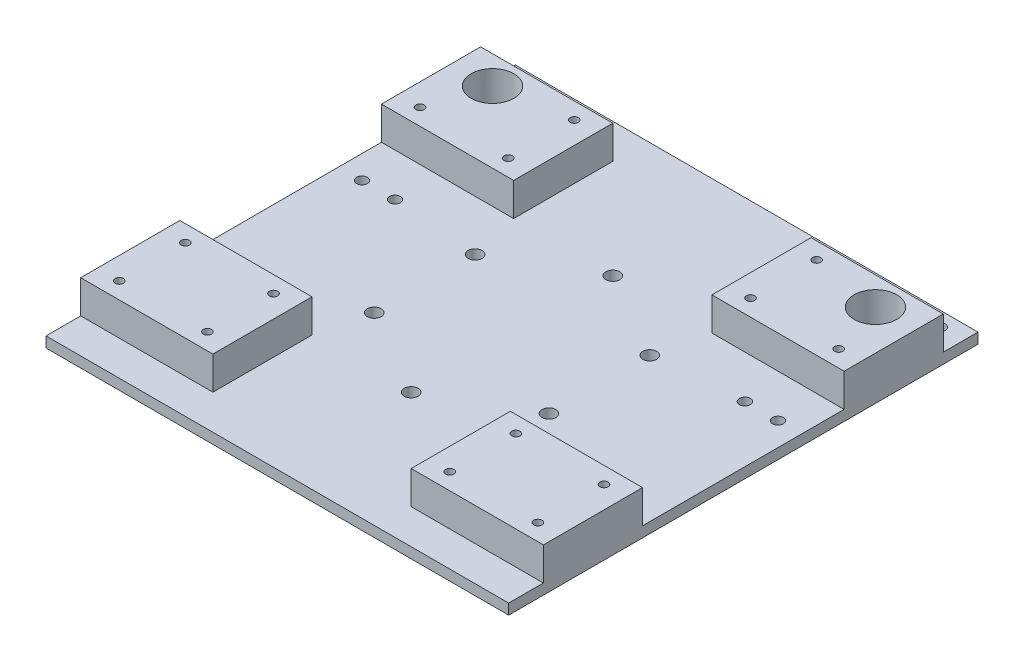
from build123d import *

# Parameters (mm, degrees)
SKETCH1_W                      = 140
SKETCH1_H                      = 142
BOSS_EXTRUDE1_DEPTH            = 3.175
SKETCH2_W                      = 40
SKETCH2_H                      = 30
SKETCH2_R                      = 1.25
BOSS_EXTRUDE2_DEPTH            = 10
CUT_EXTRUDE1_REACH             = 102.205
SKETCH4_R                      = 6.4643
SKETCH4_R_2                    = 1.65
CUT_EXTRUDE1_DIRECTION_2_REACH = 102.205
SKETCH5_R                      = 2.1
CUT_EXTRUDE2_DEPTH             = 3.175
CUT_EXTRUDE3_START             = -3.175
SKETCH6_R                      = 1.25
CUT_EXTRUDE3_DEPTH             = 3.175


with BuildPart() as part:
    # Sketch1 → Boss-Extrude1 (new body)
    with BuildSketch(Plane(origin=(0, 0, 0), x_dir=(1, 0, 0), z_dir=(0, 1, 0))):
        Rectangle(SKETCH1_W, SKETCH1_H)
    extrude(amount=BOSS_EXTRUDE1_DEPTH)

    # Sketch2 → Boss-Extrude2 (add)
    # profile 1 of 4: a face of its own
    with BuildSketch(Plane(origin=(0, 3.175, 0), x_dir=(1, 0, 0), z_dir=(0, 1, 0))):
        with Locations((-50, 45.5)):
            Rectangle(SKETCH2_W, SKETCH2_H)
        with Locations(Location((-36.666666667, 55.5, 0), (0, 0, 270))):
            Circle(SKETCH2_R, mode=Mode.SUBTRACT)
        with Locations(Location((-36.666666667, 35.5, 0), (0, 0, 90))):
            Circle(SKETCH2_R, mode=Mode.SUBTRACT)
        with Locations(Location((-63.333333333, 35.5, 0), (0, 0, 270))):
            Circle(SKETCH2_R, mode=Mode.SUBTRACT)
    # profile 2 of 4: a face of its own
    with BuildSketch(Plane(origin=(0, 3.175, 0), x_dir=(1, 0, 0), z_dir=(0, 1, 0))):
        with Locations((50, 45.5)):
            Rectangle(SKETCH2_W, SKETCH2_H)
        with Locations(Location((36.666666667, 35.5, 0), (0, 0, 270))):
            Circle(SKETCH2_R, mode=Mode.SUBTRACT)
        with Locations(Location((63.333333333, 35.5, 0), (0, 0, 90))):
            Circle(SKETCH2_R, mode=Mode.SUBTRACT)
        with Locations(Location((36.666666667, 55.5, 0), (0, 0, 90))):
            Circle(SKETCH2_R, mode=Mode.SUBTRACT)
    # profile 3 of 4: a face of its own
    with BuildSketch(Plane(origin=(0, 3.175, 0), x_dir=(1, 0, 0), z_dir=(0, 1, 0))):
        with Locations((50, -45.5)):
            Rectangle(SKETCH2_W, SKETCH2_H)
        with Locations(Location((63.333333333, -35.5, 0), (0, 0, 270))):
            Circle(SKETCH2_R, mode=Mode.SUBTRACT)
        with Locations(Location((63.333333333, -55.5, 0), (0, 0, 90))):
            Circle(SKETCH2_R, mode=Mode.SUBTRACT)
        with Locations(Location((36.666666667, -55.5, 0), (0, 0, 270))):
            Circle(SKETCH2_R, mode=Mode.SUBTRACT)
        with Locations(Location((36.666666667, -35.5, 0), (0, 0, 90))):
            Circle(SKETCH2_R, mode=Mode.SUBTRACT)
    # profile 4 of 4: a face of its own
    with BuildSketch(Plane(origin=(0, 3.175, 0), x_dir=(1, 0, 0), z_dir=(0, 1, 0))):
        with Locations((-50, -45.5)):
            Rectangle(SKETCH2_W, SKETCH2_H)
        with Locations(Location((-36.666666667, -35.5, 0), (0, 0, 270))):
            Circle(SKETCH2_R, mode=Mode.SUBTRACT)
        with Locations(Location((-63.333333333, -35.5, 0), (0, 0, 90))):
            Circle(SKETCH2_R, mode=Mode.SUBTRACT)
        with Locations(Location((-36.666666667, -55.5, 0), (0, 0, 90))):
            Circle(SKETCH2_R, mode=Mode.SUBTRACT)
        with Locations(Location((-63.333333333, -55.5, 0), (0, 0, 270))):
            Circle(SKETCH2_R, mode=Mode.SUBTRACT)
    extrude(amount=BOSS_EXTRUDE2_DEPTH)

    # Cut-Extrude1: up to this face of the body (flat: up to its plane)
    cut_extrude1_end = Plane(part.part.faces().sort_by_distance((0, 0, 0))[0])
    # Sketch4 → Cut-Extrude1 (cut, up to the picked face)
    with BuildSketch(Plane(origin=(0, 3.175, 0), x_dir=(1, 0, 0), z_dir=(0, 1, 0)), mode=Mode.PRIVATE) as cut_extrude1_sk1:
        with Locations(Location((57.9286, 52.0357, 0), (0, 0, 270))):
            Circle(SKETCH4_R)
    cut_extrude1_tool1 = split(extrude(cut_extrude1_sk1.sketch, amount=-CUT_EXTRUDE1_REACH, mode=Mode.PRIVATE), bisect_by=cut_extrude1_end, keep=Keep.BOTH, mode=Mode.PRIVATE)
    # Sketch4 → Cut-Extrude1 (cut, up to the picked face)
    with BuildSketch(Plane(origin=(0, 3.175, 0), x_dir=(1, 0, 0), z_dir=(0, 1, 0)), mode=Mode.PRIVATE) as cut_extrude1_sk2:
        with Locations(Location((62.9286, 17.5357, 0), (0, 0, 90))):
            Circle(SKETCH4_R_2)
    cut_extrude1_tool2 = split(extrude(cut_extrude1_sk2.sketch, amount=-CUT_EXTRUDE1_REACH, mode=Mode.PRIVATE), bisect_by=cut_extrude1_end, keep=Keep.BOTH, mode=Mode.PRIVATE)
    # Sketch4 → Cut-Extrude1 (cut, up to the picked face)
    with BuildSketch(Plane(origin=(0, 3.175, 0), x_dir=(1, 0, 0), z_dir=(0, 1, 0)), mode=Mode.PRIVATE) as cut_extrude1_sk3:
        with Locations(Location((-62.9286, 66.5357, 0), (0, 0, 90))):
            Circle(SKETCH4_R_2)
    cut_extrude1_tool3 = split(extrude(cut_extrude1_sk3.sketch, amount=-CUT_EXTRUDE1_REACH, mode=Mode.PRIVATE), bisect_by=cut_extrude1_end, keep=Keep.BOTH, mode=Mode.PRIVATE)
    # Sketch4 → Cut-Extrude1 (cut, up to the picked face)
    with BuildSketch(Plane(origin=(0, 3.175, 0), x_dir=(1, 0, 0), z_dir=(0, 1, 0)), mode=Mode.PRIVATE) as cut_extrude1_sk4:
        with Locations(Location((-52.9286, 66.5357, 0), (0, 0, 90))):
            Circle(SKETCH4_R_2)
    cut_extrude1_tool4 = split(extrude(cut_extrude1_sk4.sketch, amount=-CUT_EXTRUDE1_REACH, mode=Mode.PRIVATE), bisect_by=cut_extrude1_end, keep=Keep.BOTH, mode=Mode.PRIVATE)
    # Sketch4 → Cut-Extrude1 (cut, up to the picked face)
    with BuildSketch(Plane(origin=(0, 3.175, 0), x_dir=(1, 0, 0), z_dir=(0, 1, 0)), mode=Mode.PRIVATE) as cut_extrude1_sk5:
        with Locations(Location((-57.9286, 52.0357, 0), (0, 0, 270))):
            Circle(SKETCH4_R)
    cut_extrude1_tool5 = split(extrude(cut_extrude1_sk5.sketch, amount=-CUT_EXTRUDE1_REACH, mode=Mode.PRIVATE), bisect_by=cut_extrude1_end, keep=Keep.BOTH, mode=Mode.PRIVATE)
    # Sketch4 → Cut-Extrude1 (cut, up to the picked face)
    with BuildSketch(Plane(origin=(0, 3.175, 0), x_dir=(1, 0, 0), z_dir=(0, 1, 0)), mode=Mode.PRIVATE) as cut_extrude1_sk6:
        with Locations(Location((-62.9286, 17.5357, 0), (0, 0, 90))):
            Circle(SKETCH4_R_2)
    cut_extrude1_tool6 = split(extrude(cut_extrude1_sk6.sketch, amount=-CUT_EXTRUDE1_REACH, mode=Mode.PRIVATE), bisect_by=cut_extrude1_end, keep=Keep.BOTH, mode=Mode.PRIVATE)
    # Sketch4 → Cut-Extrude1 (cut, up to the picked face)
    with BuildSketch(Plane(origin=(0, 3.175, 0), x_dir=(1, 0, 0), z_dir=(0, 1, 0)), mode=Mode.PRIVATE) as cut_extrude1_sk7:
        with Locations(Location((-52.9286, 17.5357, 0), (0, 0, 90))):
            Circle(SKETCH4_R_2)
    cut_extrude1_tool7 = split(extrude(cut_extrude1_sk7.sketch, amount=-CUT_EXTRUDE1_REACH, mode=Mode.PRIVATE), bisect_by=cut_extrude1_end, keep=Keep.BOTH, mode=Mode.PRIVATE)
    # Sketch4 → Cut-Extrude1 (cut, up to the picked face)
    with BuildSketch(Plane(origin=(0, 3.175, 0), x_dir=(1, 0, 0), z_dir=(0, 1, 0)), mode=Mode.PRIVATE) as cut_extrude1_sk8:
        with Locations(Location((52.9286, 66.5357, 0), (0, 0, 90))):
            Circle(SKETCH4_R_2)
    cut_extrude1_tool8 = split(extrude(cut_extrude1_sk8.sketch, amount=-CUT_EXTRUDE1_REACH, mode=Mode.PRIVATE), bisect_by=cut_extrude1_end, keep=Keep.BOTH, mode=Mode.PRIVATE)
    # Sketch4 → Cut-Extrude1 (cut, up to the picked face)
    with BuildSketch(Plane(origin=(0, 3.175, 0), x_dir=(1, 0, 0), z_dir=(0, 1, 0)), mode=Mode.PRIVATE) as cut_extrude1_sk9:
        with Locations(Location((62.9286, 66.5357, 0), (0, 0, 90))):
            Circle(SKETCH4_R_2)
    cut_extrude1_tool9 = split(extrude(cut_extrude1_sk9.sketch, amount=-CUT_EXTRUDE1_REACH, mode=Mode.PRIVATE), bisect_by=cut_extrude1_end, keep=Keep.BOTH, mode=Mode.PRIVATE)
    # Sketch4 → Cut-Extrude1 (cut, up to the picked face)
    with BuildSketch(Plane(origin=(0, 3.175, 0), x_dir=(1, 0, 0), z_dir=(0, 1, 0)), mode=Mode.PRIVATE) as cut_extrude1_sk10:
        with Locations(Location((52.9286, 17.5357, 0), (0, 0, 90))):
            Circle(SKETCH4_R_2)
    cut_extrude1_tool10 = split(extrude(cut_extrude1_sk10.sketch, amount=-CUT_EXTRUDE1_REACH, mode=Mode.PRIVATE), bisect_by=cut_extrude1_end, keep=Keep.BOTH, mode=Mode.PRIVATE)
    add(cut_extrude1_tool1.solids().sort_by(Axis((57.9286, 3.175, -52.0357), (0, -1, 0)))[0], mode=Mode.SUBTRACT)
    add(cut_extrude1_tool2.solids().sort_by(Axis((62.9286, 3.175, -17.5357), (0, -1, 0)))[0], mode=Mode.SUBTRACT)
    add(cut_extrude1_tool3.solids().sort_by(Axis((-62.9286, 3.175, -66.5357), (0, -1, 0)))[0], mode=Mode.SUBTRACT)
    add(cut_extrude1_tool4.solids().sort_by(Axis((-52.9286, 3.175, -66.5357), (0, -1, 0)))[0], mode=Mode.SUBTRACT)
    add(cut_extrude1_tool5.solids().sort_by(Axis((-57.9286, 3.175, -52.0357), (0, -1, 0)))[0], mode=Mode.SUBTRACT)
    add(cut_extrude1_tool6.solids().sort_by(Axis((-62.9286, 3.175, -17.5357), (0, -1, 0)))[0], mode=Mode.SUBTRACT)
    add(cut_extrude1_tool7.solids().sort_by(Axis((-52.9286, 3.175, -17.5357), (0, -1, 0)))[0], mode=Mode.SUBTRACT)
    add(cut_extrude1_tool8.solids().sort_by(Axis((52.9286, 3.175, -66.5357), (0, -1, 0)))[0], mode=Mode.SUBTRACT)
    add(cut_extrude1_tool9.solids().sort_by(Axis((62.9286, 3.175, -66.5357), (0, -1, 0)))[0], mode=Mode.SUBTRACT)
    add(cut_extrude1_tool10.solids().sort_by(Axis((52.9286, 3.175, -17.5357), (0, -1, 0)))[0], mode=Mode.SUBTRACT)

    # Cut-Extrude1 direction 2: up to this face of the body (flat: up to its plane)
    cut_extrude1_direction_2_end = Plane(part.part.faces().sort_by_distance((50.05521918, 13.175, -45.541414385))[0])
    # Sketch4 → Cut-Extrude1 direction 2 (cut, up to the picked face)
    with BuildSketch(Plane(origin=(0, 3.175, 0), x_dir=(1, 0, 0), z_dir=(0, 1, 0)), mode=Mode.PRIVATE) as cut_extrude1_direction_2_sk1:
        with Locations(Location((57.9286, 52.0357, 0), (0, 0, 270))):
            Circle(SKETCH4_R)
    cut_extrude1_direction_2_tool1 = split(extrude(cut_extrude1_direction_2_sk1.sketch, amount=CUT_EXTRUDE1_DIRECTION_2_REACH, mode=Mode.PRIVATE), bisect_by=cut_extrude1_direction_2_end, keep=Keep.BOTH, mode=Mode.PRIVATE)
    # Sketch4 → Cut-Extrude1 direction 2 (cut, up to the picked face)
    with BuildSketch(Plane(origin=(0, 3.175, 0), x_dir=(1, 0, 0), z_dir=(0, 1, 0)), mode=Mode.PRIVATE) as cut_extrude1_direction_2_sk2:
        with Locations(Location((62.9286, 17.5357, 0), (0, 0, 90))):
            Circle(SKETCH4_R_2)
    cut_extrude1_direction_2_tool2 = split(extrude(cut_extrude1_direction_2_sk2.sketch, amount=CUT_EXTRUDE1_DIRECTION_2_REACH, mode=Mode.PRIVATE), bisect_by=cut_extrude1_direction_2_end, keep=Keep.BOTH, mode=Mode.PRIVATE)
    # Sketch4 → Cut-Extrude1 direction 2 (cut, up to the picked face)
    with BuildSketch(Plane(origin=(0, 3.175, 0), x_dir=(1, 0, 0), z_dir=(0, 1, 0)), mode=Mode.PRIVATE) as cut_extrude1_direction_2_sk3:
        with Locations(Location((-62.9286, 66.5357, 0), (0, 0, 90))):
            Circle(SKETCH4_R_2)
    cut_extrude1_direction_2_tool3 = split(extrude(cut_extrude1_direction_2_sk3.sketch, amount=CUT_EXTRUDE1_DIRECTION_2_REACH, mode=Mode.PRIVATE), bisect_by=cut_extrude1_direction_2_end, keep=Keep.BOTH, mode=Mode.PRIVATE)
    # Sketch4 → Cut-Extrude1 direction 2 (cut, up to the picked face)
    with BuildSketch(Plane(origin=(0, 3.175, 0), x_dir=(1, 0, 0), z_dir=(0, 1, 0)), mode=Mode.PRIVATE) as cut_extrude1_direction_2_sk4:
        with Locations(Location((-52.9286, 66.5357, 0), (0, 0, 90))):
            Circle(SKETCH4_R_2)
    cut_extrude1_direction_2_tool4 = split(extrude(cut_extrude1_direction_2_sk4.sketch, amount=CUT_EXTRUDE1_DIRECTION_2_REACH, mode=Mode.PRIVATE), bisect_by=cut_extrude1_direction_2_end, keep=Keep.BOTH, mode=Mode.PRIVATE)
    # Sketch4 → Cut-Extrude1 direction 2 (cut, up to the picked face)
    with BuildSketch(Plane(origin=(0, 3.175, 0), x_dir=(1, 0, 0), z_dir=(0, 1, 0)), mode=Mode.PRIVATE) as cut_extrude1_direction_2_sk5:
        with Locations(Location((-57.9286, 52.0357, 0), (0, 0, 270))):
            Circle(SKETCH4_R)
    cut_extrude1_direction_2_tool5 = split(extrude(cut_extrude1_direction_2_sk5.sketch, amount=CUT_EXTRUDE1_DIRECTION_2_REACH, mode=Mode.PRIVATE), bisect_by=cut_extrude1_direction_2_end, keep=Keep.BOTH, mode=Mode.PRIVATE)
    # Sketch4 → Cut-Extrude1 direction 2 (cut, up to the picked face)
    with BuildSketch(Plane(origin=(0, 3.175, 0), x_dir=(1, 0, 0), z_dir=(0, 1, 0)), mode=Mode.PRIVATE) as cut_extrude1_direction_2_sk6:
        with Locations(Location((-62.9286, 17.5357, 0), (0, 0, 90))):
            Circle(SKETCH4_R_2)
    cut_extrude1_direction_2_tool6 = split(extrude(cut_extrude1_direction_2_sk6.sketch, amount=CUT_EXTRUDE1_DIRECTION_2_REACH, mode=Mode.PRIVATE), bisect_by=cut_extrude1_direction_2_end, keep=Keep.BOTH, mode=Mode.PRIVATE)
    # Sketch4 → Cut-Extrude1 direction 2 (cut, up to the picked face)
    with BuildSketch(Plane(origin=(0, 3.175, 0), x_dir=(1, 0, 0), z_dir=(0, 1, 0)), mode=Mode.PRIVATE) as cut_extrude1_direction_2_sk7:
        with Locations(Location((-52.9286, 17.5357, 0), (0, 0, 90))):
            Circle(SKETCH4_R_2)
    cut_extrude1_direction_2_tool7 = split(extrude(cut_extrude1_direction_2_sk7.sketch, amount=CUT_EXTRUDE1_DIRECTION_2_REACH, mode=Mode.PRIVATE), bisect_by=cut_extrude1_direction_2_end, keep=Keep.BOTH, mode=Mode.PRIVATE)
    # Sketch4 → Cut-Extrude1 direction 2 (cut, up to the picked face)
    with BuildSketch(Plane(origin=(0, 3.175, 0), x_dir=(1, 0, 0), z_dir=(0, 1, 0)), mode=Mode.PRIVATE) as cut_extrude1_direction_2_sk8:
        with Locations(Location((52.9286, 66.5357, 0), (0, 0, 90))):
            Circle(SKETCH4_R_2)
    cut_extrude1_direction_2_tool8 = split(extrude(cut_extrude1_direction_2_sk8.sketch, amount=CUT_EXTRUDE1_DIRECTION_2_REACH, mode=Mode.PRIVATE), bisect_by=cut_extrude1_direction_2_end, keep=Keep.BOTH, mode=Mode.PRIVATE)
    # Sketch4 → Cut-Extrude1 direction 2 (cut, up to the picked face)
    with BuildSketch(Plane(origin=(0, 3.175, 0), x_dir=(1, 0, 0), z_dir=(0, 1, 0)), mode=Mode.PRIVATE) as cut_extrude1_direction_2_sk9:
        with Locations(Location((62.9286, 66.5357, 0), (0, 0, 90))):
            Circle(SKETCH4_R_2)
    cut_extrude1_direction_2_tool9 = split(extrude(cut_extrude1_direction_2_sk9.sketch, amount=CUT_EXTRUDE1_DIRECTION_2_REACH, mode=Mode.PRIVATE), bisect_by=cut_extrude1_direction_2_end, keep=Keep.BOTH, mode=Mode.PRIVATE)
    # Sketch4 → Cut-Extrude1 direction 2 (cut, up to the picked face)
    with BuildSketch(Plane(origin=(0, 3.175, 0), x_dir=(1, 0, 0), z_dir=(0, 1, 0)), mode=Mode.PRIVATE) as cut_extrude1_direction_2_sk10:
        with Locations(Location((52.9286, 17.5357, 0), (0, 0, 90))):
            Circle(SKETCH4_R_2)
    cut_extrude1_direction_2_tool10 = split(extrude(cut_extrude1_direction_2_sk10.sketch, amount=CUT_EXTRUDE1_DIRECTION_2_REACH, mode=Mode.PRIVATE), bisect_by=cut_extrude1_direction_2_end, keep=Keep.BOTH, mode=Mode.PRIVATE)
    add(cut_extrude1_direction_2_tool1.solids().sort_by(Axis((57.9286, 3.175, -52.0357), (0, 1, 0)))[0], mode=Mode.SUBTRACT)
    add(cut_extrude1_direction_2_tool2.solids().sort_by(Axis((62.9286, 3.175, -17.5357), (0, 1, 0)))[0], mode=Mode.SUBTRACT)
    add(cut_extrude1_direction_2_tool3.solids().sort_by(Axis((-62.9286, 3.175, -66.5357), (0, 1, 0)))[0], mode=Mode.SUBTRACT)
    add(cut_extrude1_direction_2_tool4.solids().sort_by(Axis((-52.9286, 3.175, -66.5357), (0, 1, 0)))[0], mode=Mode.SUBTRACT)
    add(cut_extrude1_direction_2_tool5.solids().sort_by(Axis((-57.9286, 3.175, -52.0357), (0, 1, 0)))[0], mode=Mode.SUBTRACT)
    add(cut_extrude1_direction_2_tool6.solids().sort_by(Axis((-62.9286, 3.175, -17.5357), (0, 1, 0)))[0], mode=Mode.SUBTRACT)
    add(cut_extrude1_direction_2_tool7.solids().sort_by(Axis((-52.9286, 3.175, -17.5357), (0, 1, 0)))[0], mode=Mode.SUBTRACT)
    add(cut_extrude1_direction_2_tool8.solids().sort_by(Axis((52.9286, 3.175, -66.5357), (0, 1, 0)))[0], mode=Mode.SUBTRACT)
    add(cut_extrude1_direction_2_tool9.solids().sort_by(Axis((62.9286, 3.175, -66.5357), (0, 1, 0)))[0], mode=Mode.SUBTRACT)
    add(cut_extrude1_direction_2_tool10.solids().sort_by(Axis((52.9286, 3.175, -17.5357), (0, 1, 0)))[0], mode=Mode.SUBTRACT)

    # Sketch5 → Cut-Extrude2 (cut)
    with BuildSketch(Plane(origin=(0, 3.175, 0), x_dir=(1, 0, 0), z_dir=(0, 1, 0))):
        with Locations(Location((0, 30.525, 0), (0, 0, 270))):
            Circle(SKETCH5_R)
        with Locations(Location((26.435425451, 15.2625, 0), (0, 0, 270))):
            Circle(SKETCH5_R)
        with Locations(Location((26.435425451, -15.2625, 0), (0, 0, 270))):
            Circle(SKETCH5_R)
        with Locations(Location((0, -30.525, 0), (0, 0, 270))):
            Circle(SKETCH5_R)
        with Locations(Location((-26.435425451, -15.2625, 0), (0, 0, 270))):
            Circle(SKETCH5_R)
        with Locations(Location((-26.435425451, 15.2625, 0), (0, 0, 270))):
            Circle(SKETCH5_R)
    extrude(amount=-CUT_EXTRUDE2_DEPTH, mode=Mode.SUBTRACT)

    # Sketch6 → Cut-Extrude3 (cut)
    with BuildSketch(Plane(origin=(0, 3.175, 0), x_dir=(1, 0, 0), z_dir=(0, 1, 0)).offset(CUT_EXTRUDE3_START)):
        with Locations(Location((-36.666666667, 35.5, 0), (0, 0, 90))):
            Circle(SKETCH6_R)
        with Locations(Location((-63.333333333, 35.5, 0), (0, 0, 90))):
            Circle(SKETCH6_R)
        with Locations(Location((-36.666666667, 55.5, 0), (0, 0, 90))):
            Circle(SKETCH6_R)
        with Locations(Location((36.666666667, 55.5, 0), (0, 0, 90))):
            Circle(SKETCH6_R)
        with Locations(Location((36.666666667, 35.5, 0), (0, 0, 90))):
            Circle(SKETCH6_R)
        with Locations(Location((63.333333333, 35.5, 0), (0, 0, 90))):
            Circle(SKETCH6_R)
        with Locations(Location((63.333333333, -55.5, 0), (0, 0, 90))):
            Circle(SKETCH6_R)
        with Locations(Location((63.333333333, -35.5, 0), (0, 0, 90))):
            Circle(SKETCH6_R)
        with Locations(Location((36.666666667, -35.5, 0), (0, 0, 90))):
            Circle(SKETCH6_R)
        with Locations(Location((36.666666667, -55.5, 0), (0, 0, 90))):
            Circle(SKETCH6_R)
        with Locations(Location((-36.666666667, -55.5, 0), (0, 0, 90))):
            Circle(SKETCH6_R)
        with Locations(Location((-63.333333333, -55.5, 0), (0, 0, 90))):
            Circle(SKETCH6_R)
        with Locations(Location((-63.333333333, -35.5, 0), (0, 0, 90))):
            Circle(SKETCH6_R)
        with Locations(Location((-36.666666667, -35.5, 0), (0, 0, 90))):
            Circle(SKETCH6_R)
    extrude(amount=CUT_EXTRUDE3_DEPTH, mode=Mode.SUBTRACT)


solid = part.part
